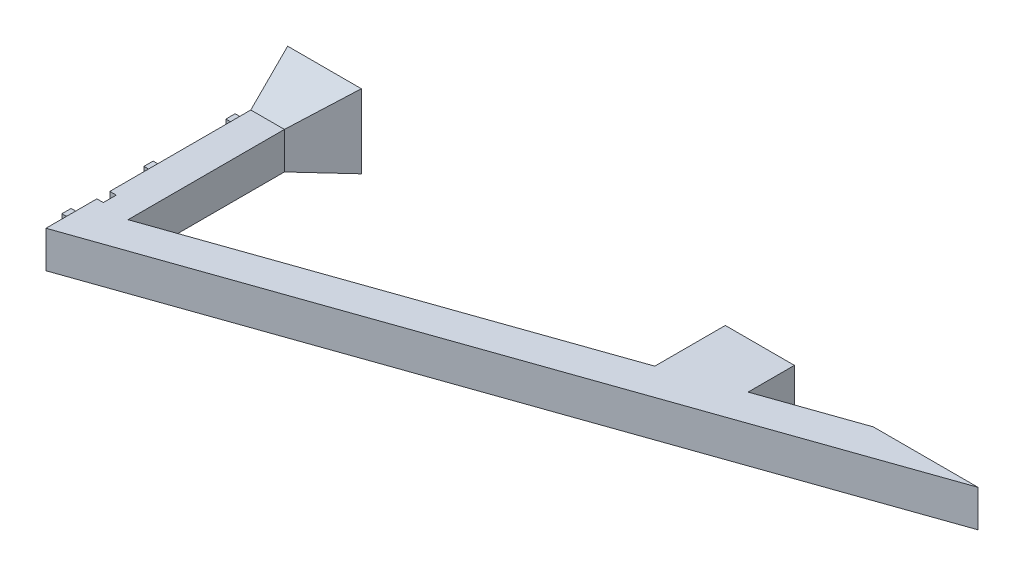
from build123d import *

# Parameters (mm, degrees)
P_IDAT_VYSUNUT_M1_DEPTH  = 8
SKICA2_W                 = 1.4
SKICA2_H                 = 2.8
ODEBRAT_VYSUNUT_M1_DEPTH = 4.4
SKICA3_W                 = 2
SKICA3_H                 = 2
P_IDAT_VYSUNUT_M2_DEPTH  = 4
P_IDAT_START             = 8
SKICA5_W                 = 16
SKICA5_H                 = 8
P_IDAT_VYSUNUT_M4_DEPTH  = 16
ODEBRAT_VYSUNUT_M2_DEPTH = 161.57934176
ODEBRAT_VYSUNUT_M3_DEPTH = 161.57934176


with BuildPart() as part:
    # Skica1 → Přidat vysunutím1 (new body)
    with BuildSketch(Plane(origin=(0, 0, 0), x_dir=(1, 0, 0), z_dir=(0, 1, 0))):
        Polygon((0, 0), (0, -55.45), (149.85, -3), (127.147799643, -3), (107, -10.052066008), (107, 0), (92, 0), (92, -15.302316258), (7.3, -44.948729338), (7.3, 0), align=None)
    extrude(amount=P_IDAT_VYSUNUT_M1_DEPTH)

    # Skica2 → Odebrat vysunutím1 (cut)
    with BuildSketch(Plane(origin=(0, 8, 0), x_dir=(1, 0, 0), z_dir=(0, 1, 0))):
        with Locations((0.7, -43)):
            Rectangle(SKICA2_W, SKICA2_H)
    extrude(amount=-ODEBRAT_VYSUNUT_M1_DEPTH, mode=Mode.SUBTRACT)

    # Skica3 → Přidat vysunutím2 (add)
    with BuildSketch(Plane.ZY):
        with Locations((11.4, 4)):
            Rectangle(SKICA3_W, SKICA3_H)
        with Locations((29.2, 4)):
            Rectangle(SKICA3_W, SKICA3_H)
        with Locations((47, 4)):
            Rectangle(SKICA3_W, SKICA3_H)
    extrude(amount=P_IDAT_VYSUNUT_M2_DEPTH)

    # Skica5 → Přidat vysunutím4 (add)
    with BuildSketch(Plane(origin=(0, 8, 0), x_dir=(1, 0, 0), z_dir=(0, 1, 0)).offset(P_IDAT_START)):
        with Locations((8, -7)):
            Rectangle(SKICA5_W, SKICA5_H)
    extrude(amount=-P_IDAT_VYSUNUT_M4_DEPTH)

    # Skica6 → Odebrat vysunutím2 (cut, through all)
    with BuildSketch(Plane.ZY):
        Polygon((3, 16), (11, 16), (11, 8), align=None)
    extrude(amount=-ODEBRAT_VYSUNUT_M2_DEPTH, mode=Mode.SUBTRACT)

    # Skica7 → Odebrat vysunutím3 (cut, through all)
    with BuildSketch(Plane.XZ):
        Polygon((7.3, 11), (16, 11), (16, 3), align=None)
    extrude(amount=-ODEBRAT_VYSUNUT_M3_DEPTH, mode=Mode.SUBTRACT)


solid = part.part
